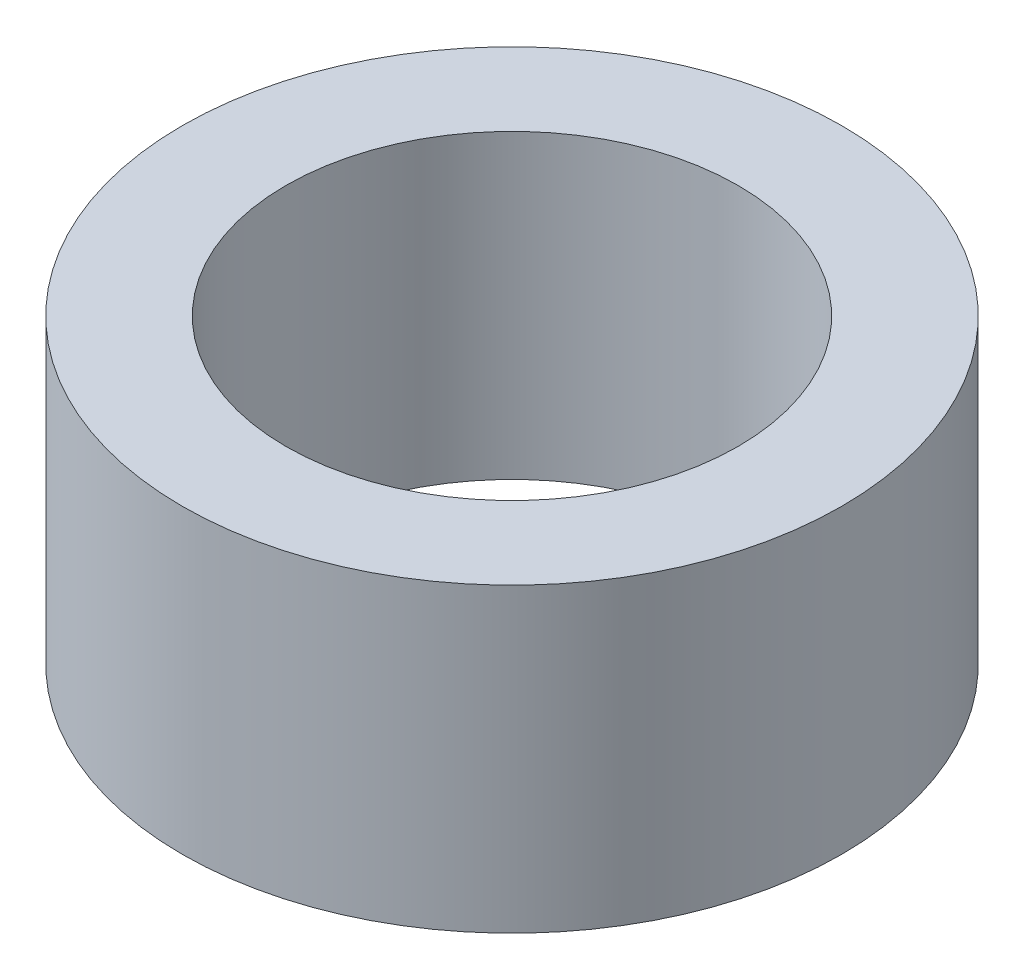
from build123d import *

# Parameters (mm, degrees)
SKETCH1_R           = 11.1125
BOSS_EXTRUDE1_DEPTH = 10.16
SKETCH4_R           = 7.62
CUT_EXTRUDE1_DEPTH  = 19.713655776


with BuildPart() as part:
    # Sketch1 → Boss-Extrude1 (new body)
    with BuildSketch(Plane(origin=(0, 0, 0), x_dir=(1, 0, 0), z_dir=(0, 1, 0))):
        with Locations(Location((0, 0, 0), (0, 0, 270))):
            Circle(SKETCH1_R)
    extrude(amount=BOSS_EXTRUDE1_DEPTH)

    # Sketch4 → Cut-Extrude1 (cut, through all)
    with BuildSketch(Plane(origin=(0, 10.16, 0), x_dir=(1, 0, 0), z_dir=(0, 1, 0))):
        with Locations(Location((0, 0, 0), (0, 0, 270))):
            Circle(SKETCH4_R)
    extrude(amount=-CUT_EXTRUDE1_DEPTH, mode=Mode.SUBTRACT)


solid = part.part
